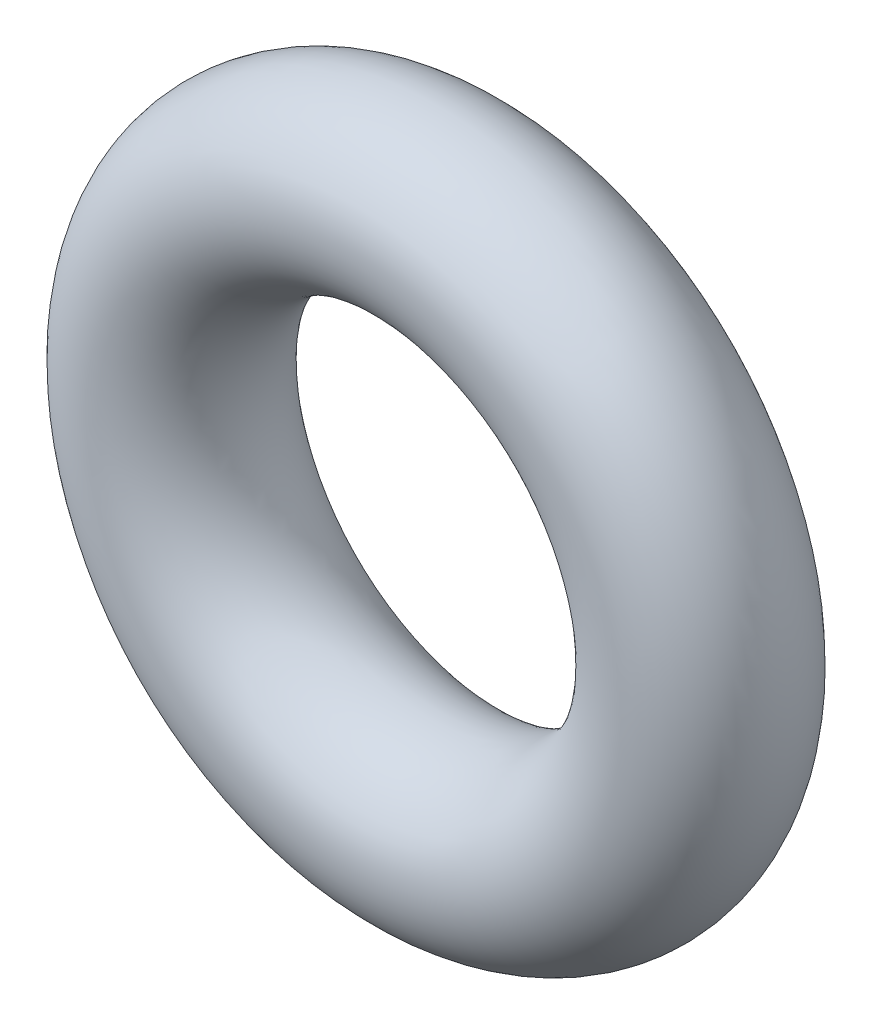
from build123d import *

# Parameters (mm, degrees)
SKETCH1_R = 1.3081


with BuildPart() as part:
    # Sketch1 → Revolve1 (revolve)
    with BuildSketch(Plane(origin=(0, 0, 0), x_dir=(0, -1, 0), z_dir=(1, 0, 0)), mode=Mode.PRIVATE) as revolve1_sk:
        with Locations((3.9243, 0)):
            Circle(SKETCH1_R)
    revolve(revolve1_sk.sketch.rotate(Axis((0, 0, 1.3081), (0, 0, -1)), 270), axis=Axis((0, 0, 1.3081), (0, 0, -1)))


solid = part.part
